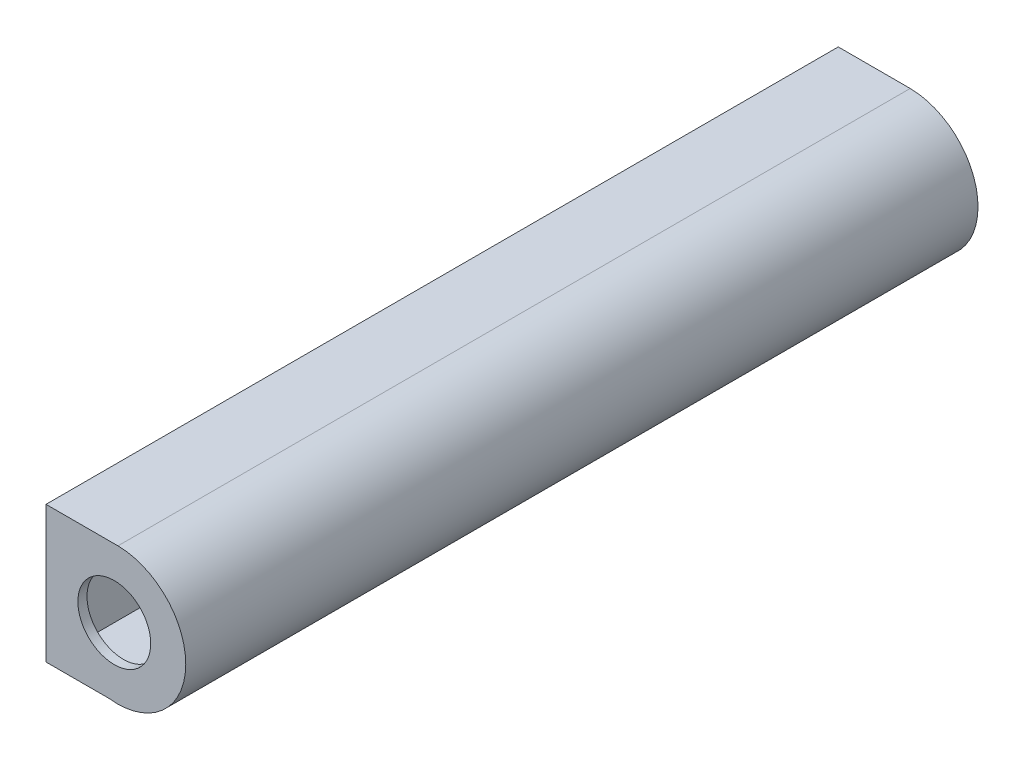
from build123d import *

# Parameters (mm, degrees)
SALIENTE_EXTRUIR1_DEPTH = 87
SALIENTE_EXTRUIR2_START = -1
CROQUIS2_R              = 4
SALIENTE_EXTRUIR2_DEPTH = 1


with BuildPart() as part:
    # Croquis1 → Saliente-Extruir1 (new body)
    with BuildSketch(Plane.XY):
        with BuildLine():
            Line((-5.675682168, 13.871979869), (-13.577452672, 13.871979869))
            Line((-13.577452672, 13.871979869), (-13.577452672, -1.128020131))
            Line((-13.577452672, -1.128020131), (-6.693069658, -1.128020131))
            ThreePointArc((-6.693069658, -1.128020131), (1.75257721, 5.833649414), (-5.675682168, 13.871979869))
        make_face()
        with BuildLine():
            Line((-12.077452672, 12.371979869), (-5.877452672, 12.371979869))
            ThreePointArc((-5.877452672, 12.371979869), (0.122547328, 6.371979869), (-5.877452672, 0.371979869))
            Line((-5.877452672, 0.371979869), (-12.077452672, 0.371979869))
            Line((-12.077452672, 0.371979869), (-12.077452672, 12.371979869))
        make_face(mode=Mode.SUBTRACT)
    extrude(amount=SALIENTE_EXTRUIR1_DEPTH)

    # Croquis2 → Saliente-Extruir2 (add)
    with BuildSketch(Plane.XY.offset(87).offset(SALIENTE_EXTRUIR2_START)):
        with BuildLine():
            Line((-13.577452672, 13.871979869), (-13.577452672, -1.128020131))
            Line((-13.577452672, -1.128020131), (-4.825831505, -1.128020131))
            ThreePointArc((-4.825831505, -1.128020131), (1.757780912, 6.769060566), (-5.675682168, 13.871979869))
            Line((-5.675682168, 13.871979869), (-13.577452672, 13.871979869))
        make_face()
        with Locations((-6.077452672, 6.371979869)):
            Circle(CROQUIS2_R, mode=Mode.SUBTRACT)
    extrude(amount=SALIENTE_EXTRUIR2_DEPTH)


solid = part.part
